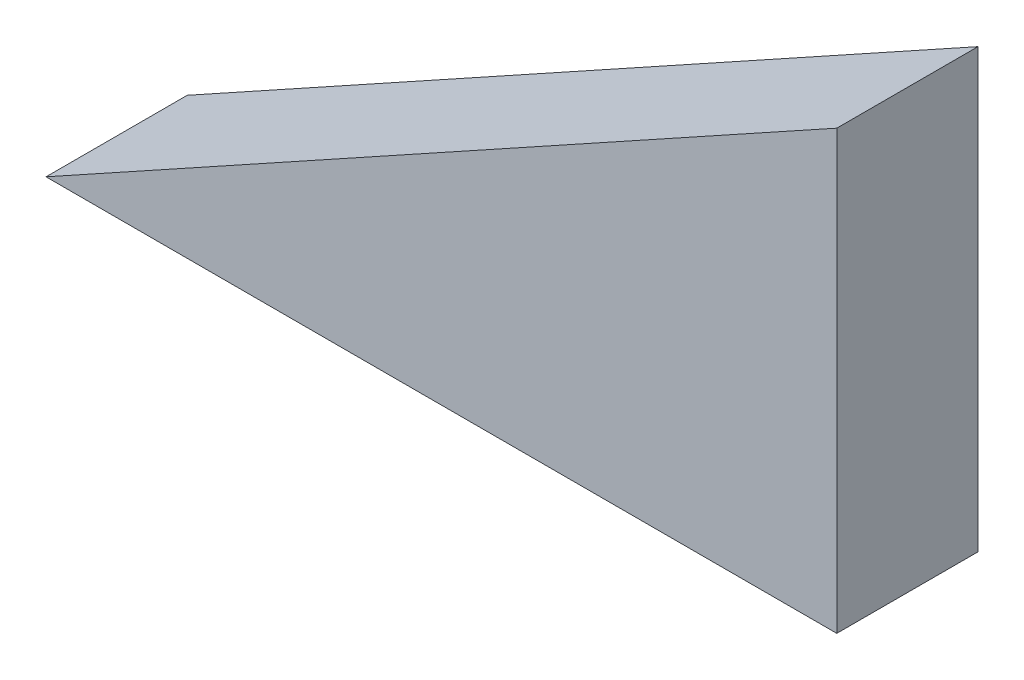
from build123d import *

# Parameters (mm, degrees)
BOSS_EXTRUDE1_DEPTH = 5


with BuildPart() as part:
    # Sketch1 → Boss-Extrude1 (new body)
    with BuildSketch(Plane.XY):
        Polygon((0, 0), (28, 0), (28, 15.491933385), align=None)
    extrude(amount=BOSS_EXTRUDE1_DEPTH)


solid = part.part
